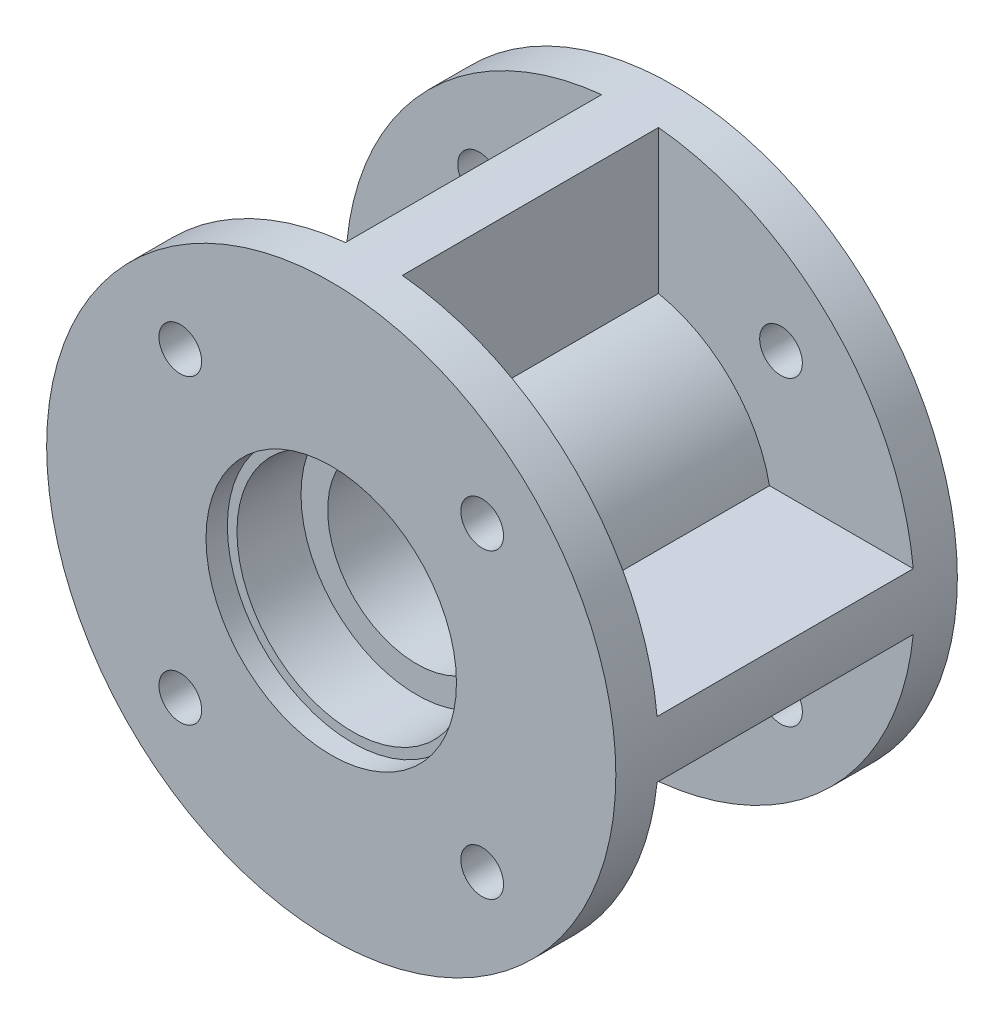
from build123d import *

# Parameters (mm, degrees)
SKETCH1_R            = 40
SKETCH1_R_2          = 12.5
BOSS_EXTRUDE1_DEPTH  = 6
SKETCH2_R            = 20
SKETCH2_R_2          = 12.5
BOSS_EXTRUDE2_DEPTH  = 30
SKETCH6_R            = 20
SKETCH6_R_2          = 16.25
BOSS_EXTRUDE5_DEPTH  = 12
BOSS_EXTRUDE6_DEPTH  = 42
SKETCH9_R            = 17.6
CUT_EXTRUDE1_DEPTH   = 3
BOSS_EXTRUDE14_START = -6
SKETCH11_R           = 40
SKETCH11_R_2         = 20
BOSS_EXTRUDE14_DEPTH = 6
SKETCH12_R           = 3
CUT_EXTRUDE2_DEPTH   = 78


with BuildPart() as part:
    # Sketch1 → Boss-Extrude1 (new body)
    with BuildSketch(Plane.XY):
        Circle(SKETCH1_R)
        Circle(SKETCH1_R_2, mode=Mode.SUBTRACT)
    extrude(amount=BOSS_EXTRUDE1_DEPTH)

    # Sketch2 → Boss-Extrude2 (add)
    with BuildSketch(Plane.XY.offset(6)):
        Circle(SKETCH2_R)
        Circle(SKETCH2_R_2, mode=Mode.SUBTRACT)
    extrude(amount=BOSS_EXTRUDE2_DEPTH)

    # Sketch6 → Boss-Extrude5 (add)
    with BuildSketch(Plane.XY.offset(36)):
        Circle(SKETCH6_R)
        Circle(SKETCH6_R_2, mode=Mode.SUBTRACT)
    extrude(amount=BOSS_EXTRUDE5_DEPTH)

    # Sketch8 → Boss-Extrude6 (add)
    with BuildSketch(Plane.XY.offset(6)):
        with BuildLine():
            Line((4, -39.799497484), (4, -19.595917942))
            ThreePointArc((4, -19.595917942), (0, -20), (-4, -19.595917942))
            Line((-4, -19.595917942), (-4, -39.799497484))
            ThreePointArc((-4, -39.799497484), (0, -40), (4, -39.799497484))
        make_face()
        with BuildLine():
            Line((39.799497484, 4), (19.595917942, 4))
            ThreePointArc((19.595917942, 4), (20, 0), (19.595917942, -4))
            Line((19.595917942, -4), (39.799497484, -4))
            ThreePointArc((39.799497484, -4), (40, 0), (39.799497484, 4))
        make_face()
        with BuildLine():
            Line((-39.799497484, -4), (-19.595917942, -4))
            ThreePointArc((-19.595917942, -4), (-20, 0), (-19.595917942, 4))
            Line((-19.595917942, 4), (-39.799497484, 4))
            ThreePointArc((-39.799497484, 4), (-40, 0), (-39.799497484, -4))
        make_face()
        with BuildLine():
            Line((-4, 39.799497484), (-4, 19.595917942))
            ThreePointArc((-4, 19.595917942), (0, 20), (4, 19.595917942))
            Line((4, 19.595917942), (4, 39.799497484))
            ThreePointArc((4, 39.799497484), (0, 40), (-4, 39.799497484))
        make_face()
    extrude(amount=BOSS_EXTRUDE6_DEPTH)

    # Sketch9 → Cut-Extrude1 (cut)
    with BuildSketch(Plane.XY.offset(48)):
        Circle(SKETCH9_R)
    extrude(amount=-CUT_EXTRUDE1_DEPTH, mode=Mode.SUBTRACT)

    # Sketch11 → Boss-Extrude14 (add)
    with BuildSketch(Plane.XY.offset(48).offset(BOSS_EXTRUDE14_START)):
        Circle(SKETCH11_R)
        Circle(SKETCH11_R_2, mode=Mode.SUBTRACT)
    extrude(amount=BOSS_EXTRUDE14_DEPTH)

    # Sketch12 → Cut-Extrude2 (cut)
    with BuildSketch(Plane(origin=(0, 0, 0), x_dir=(-1, 0, 0), z_dir=(0, 0, -1))):
        with Locations(Location((-21.213203436, 21.213203436, 0), (0, 0, 180))):
            Circle(SKETCH12_R)
        with Locations(Location((21.213203436, 21.213203436, 0), (0, 0, 180))):
            Circle(SKETCH12_R)
        with Locations(Location((21.213203436, -21.213203436, 0), (0, 0, 180))):
            Circle(SKETCH12_R)
        with Locations(Location((-21.213203436, -21.213203436, 0), (0, 0, 180))):
            Circle(SKETCH12_R)
    extrude(amount=-CUT_EXTRUDE2_DEPTH, mode=Mode.SUBTRACT)


solid = part.part
